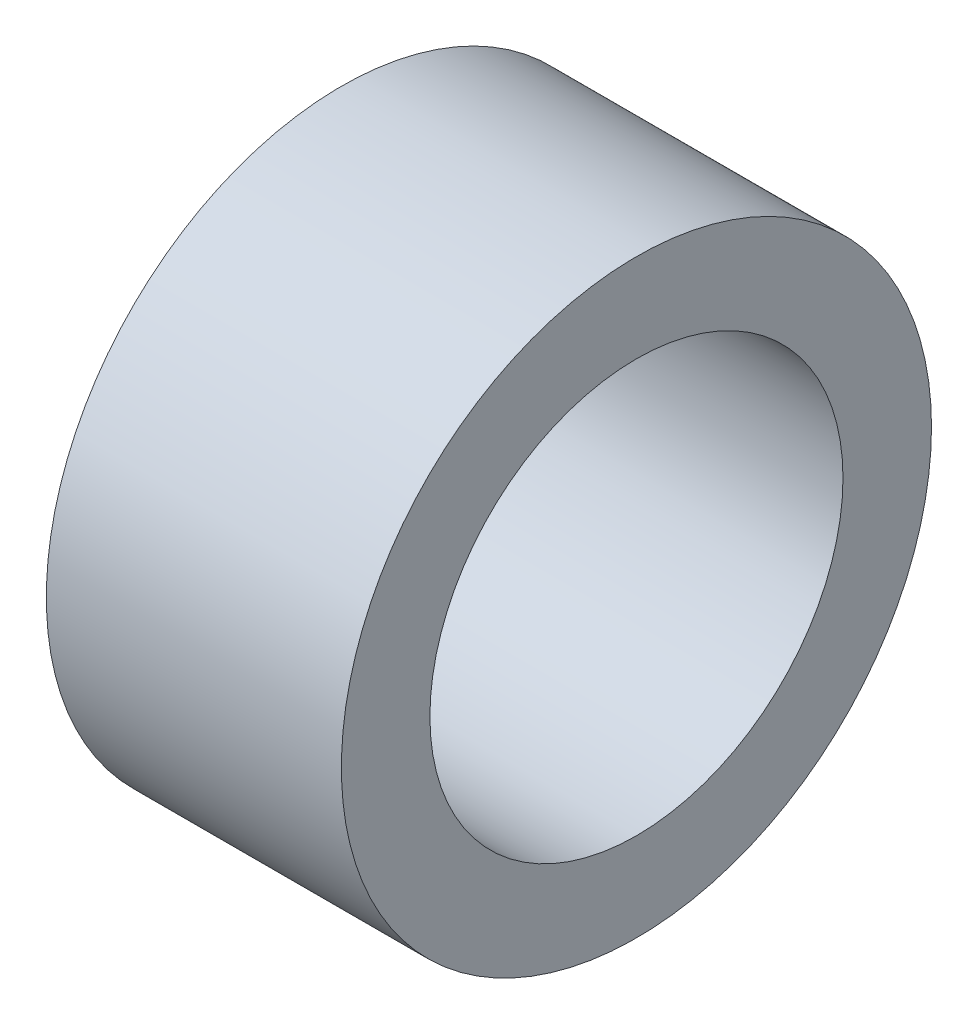
from build123d import *

# Parameters (mm, degrees)
SKETCH1_R           = 5
SKETCH1_R_2         = 3.5
BOSS_EXTRUDE1_DEPTH = 5


with BuildPart() as part:
    # Sketch1 → Boss-Extrude1 (new body)
    with BuildSketch(Plane(origin=(0, 0, 0), x_dir=(0, 0, -1), z_dir=(1, 0, 0))):
        Circle(SKETCH1_R)
        Circle(SKETCH1_R_2, mode=Mode.SUBTRACT)
    extrude(amount=BOSS_EXTRUDE1_DEPTH)


solid = part.part
